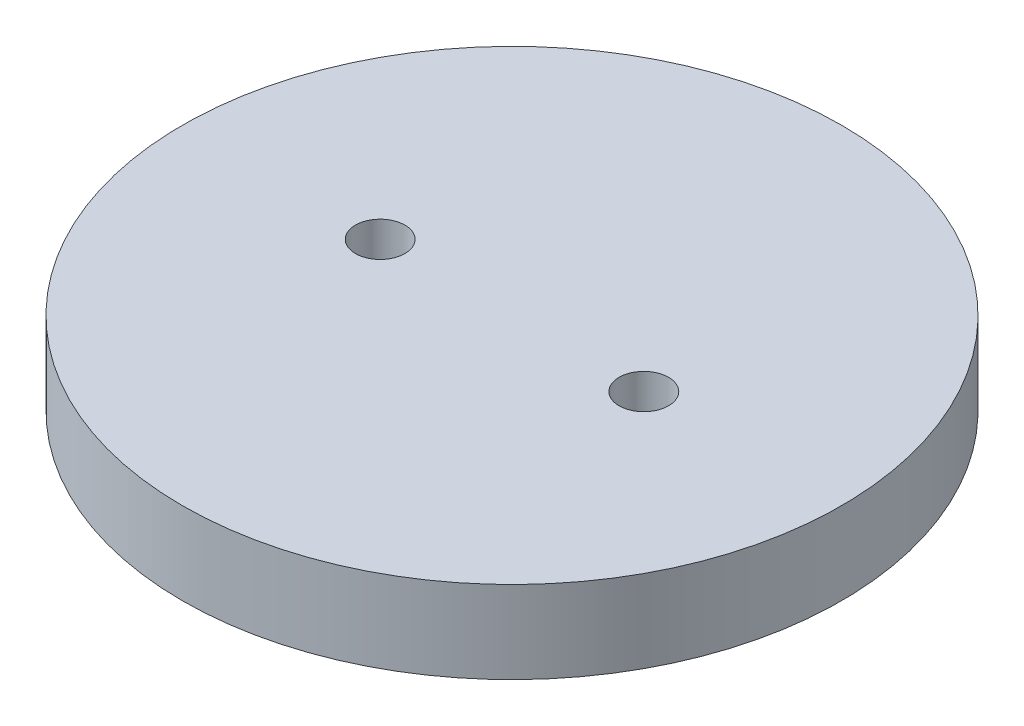
from build123d import *

# Parameters (mm, degrees)
SKETCH1_R           = 20
BOSS_EXTRUDE1_DEPTH = 5
SKETCH2_R           = 1.5
CUT_EXTRUDE1_DEPTH  = 5


with BuildPart() as part:
    # Sketch1 → Boss-Extrude1 (new body)
    with BuildSketch(Plane(origin=(0, 0, 0), x_dir=(1, 0, 0), z_dir=(0, 1, 0))):
        with Locations(Location((0, 0, 0), (0, 0, 270))):
            Circle(SKETCH1_R)
    extrude(amount=BOSS_EXTRUDE1_DEPTH)

    # Sketch2 → Cut-Extrude1 (cut)
    with BuildSketch(Plane(origin=(0, 5, 0), x_dir=(1, 0, 0), z_dir=(0, 1, 0))):
        with Locations(Location((8, 0, 0), (0, 0, 270))):
            Circle(SKETCH2_R)
        with Locations(Location((-8, 0, 0), (0, 0, 270))):
            Circle(SKETCH2_R)
    extrude(amount=-CUT_EXTRUDE1_DEPTH, mode=Mode.SUBTRACT)


solid = part.part
